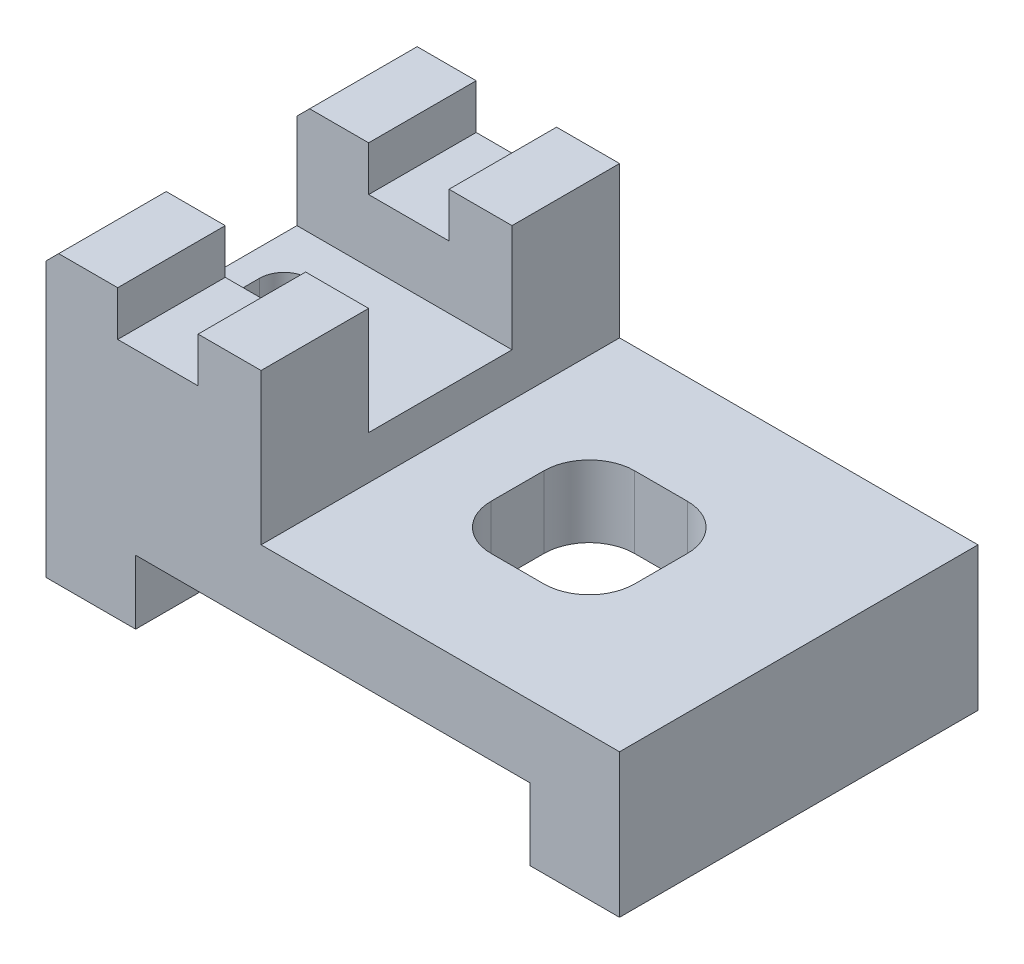
from build123d import *

# Parameters (mm, degrees)
BOSS_EXTRUDE1_DEPTH = 63.5
SKETCH5_W           = 38.1
SKETCH5_H           = 25.4
CUT_EXTRUDE1_DEPTH  = 19.05
CUT_EXTRUDE2_DEPTH  = 12.7
CUT_EXTRUDE3_DEPTH  = 13.97


with BuildPart() as part:
    # Sketch1 → Boss-Extrude1 (new body)
    with BuildSketch(Plane.XY):
        Polygon((-30.358125429, 24.501905667), (-30.358125429, -24.053030303), (-14.483125429, -24.053030303), (-14.483125429, -12.7), (55.357945402, -12.7), (55.357945402, -25.4), (71.232945402, -25.4), (71.232945402, 0), (7.741874571, 0), (7.741874571, 26.746969697), (-3.41873149, 26.746969697), (-3.41873149, 18.809469697), (-17.658125429, 18.809469697), (-17.658125429, 26.746969697), (-28.113061399, 26.746969697), align=None)
    extrude(amount=BOSS_EXTRUDE1_DEPTH)

    # Sketch5 → Cut-Extrude1 (cut)
    with BuildSketch(Plane(origin=(0, 26.746969697, 0), x_dir=(1, 0, 0), z_dir=(0, 1, 0))):
        with Locations((-11.308125429, -31.75)):
            Rectangle(SKETCH5_W, SKETCH5_H)
    extrude(amount=-CUT_EXTRUDE1_DEPTH, mode=Mode.SUBTRACT)

    # Sketch6 → Cut-Extrude2 (cut)
    with BuildSketch(Plane(origin=(0, 0, 0), x_dir=(1, 0, 0), z_dir=(0, 1, 0))):
        with BuildLine():
            Line((29.459066372, -19.05), (38.786778405, -19.05))
            ThreePointArc((38.786778405, -19.05), (44.46919031, -21.403732078), (46.822922388, -27.086143983))
            Line((46.822922388, -27.086143983), (46.822922388, -36.413856017))
            ThreePointArc((46.822922388, -36.413856017), (44.46919031, -42.096267922), (38.786778405, -44.45))
            Line((38.786778405, -44.45), (29.459066372, -44.45))
            ThreePointArc((29.459066372, -44.45), (23.776654467, -42.096267922), (21.422922388, -36.413856017))
            Line((21.422922388, -36.413856017), (21.422922388, -27.086143983))
            ThreePointArc((21.422922388, -27.086143983), (23.776654467, -21.403732078), (29.459066372, -19.05))
        make_face()
    extrude(amount=-CUT_EXTRUDE2_DEPTH, mode=Mode.SUBTRACT)

    # Sketch7 → Cut-Extrude3 (cut)
    with BuildSketch(Plane(origin=(0, 7.696969697, 0), x_dir=(1, 0, 0), z_dir=(0, 1, 0))):
        with BuildLine():
            Line((-21.28655142, -26.111602122), (-14.029699438, -26.111602122))
            ThreePointArc((-14.029699438, -26.111602122), (-10.982723986, -27.373700678), (-9.720625429, -30.420676131))
            Line((-9.720625429, -30.420676131), (-9.720625429, -33.079323869))
            ThreePointArc((-9.720625429, -33.079323869), (-10.982723986, -36.126299322), (-14.029699438, -37.388397878))
            Line((-14.029699438, -37.388397878), (-21.28655142, -37.388397878))
            ThreePointArc((-21.28655142, -37.388397878), (-24.333526873, -36.126299322), (-25.595625429, -33.079323869))
            Line((-25.595625429, -33.079323869), (-25.595625429, -30.420676131))
            ThreePointArc((-25.595625429, -30.420676131), (-24.333526873, -27.373700678), (-21.28655142, -26.111602122))
        make_face()
    extrude(amount=-CUT_EXTRUDE3_DEPTH, mode=Mode.SUBTRACT)


solid = part.part
